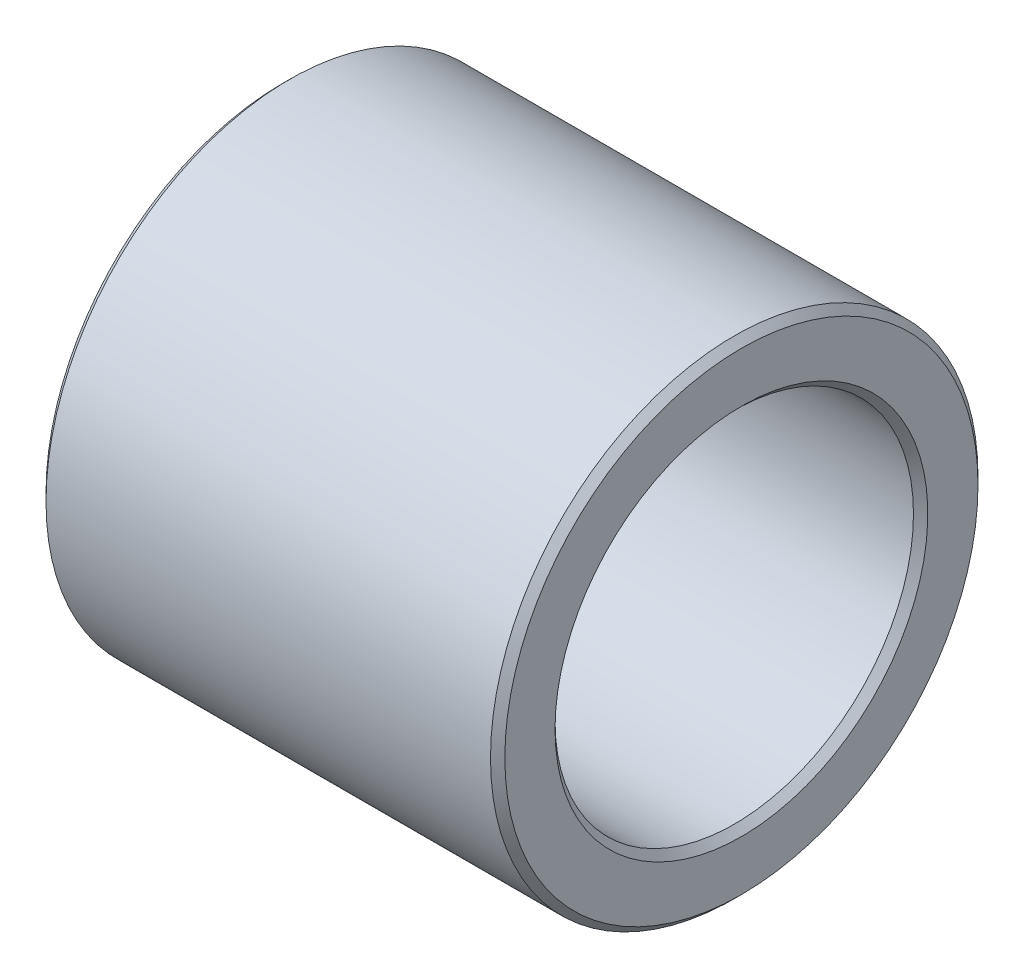
from build123d import *

# Parameters (mm, degrees)
SKETCH_1_W     = 32
SKETCH_1_H     = 4.5
CHAMFER_1_SIZE = 0.5


with BuildPart() as part:
    # Эскиз1 → Повернуть1 (revolve)
    with BuildSketch(Plane.XY):
        with Locations((0, 14.75)):
            Rectangle(SKETCH_1_W, SKETCH_1_H)
    revolve(axis=Axis((-15.228360675, 0, 0), (1, 0, 0)))

    # Фаска1
    chamfer_1_edges = [part.edges().sort_by_distance(p)[0] for p in [
        (-16, -12.5, 0),
        (-16, -17, 0),
        (16, -17, 0),
        (16, -12.5, 0),
    ]]
    chamfer(chamfer_1_edges, length=CHAMFER_1_SIZE)


solid = part.part
